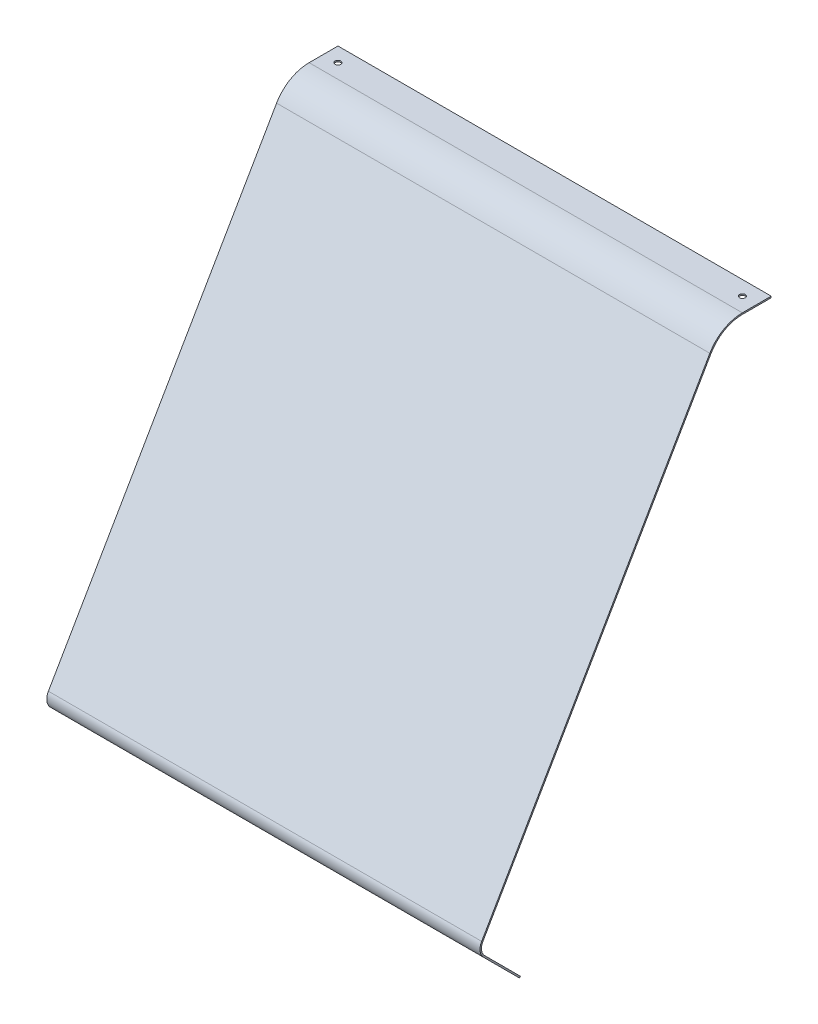
from build123d import *

# Parameters (mm, degrees)
SURFACE_EXTRUDE1_1_DEPTH = 600
THICKEN1_T1              = 2
SKETCH3_R                = 4
CUT_EXTRUDE1_DEPTH       = 2
SKETCH4_R                = 4
CUT_EXTRUDE2_DEPTH       = 2
LPATTERN1_COUNT          = 2
LPATTERN1_PITCH          = 560


with BuildPart() as body_1:
    # Surface-Extrude1: a surface, the sketch's curves swept straight by 600 mm
    with BuildLine(Plane(origin=(0, 0, 0), x_dir=(0, 0, -1), z_dir=(1, 0, 0)), mode=Mode.PRIVATE) as surface_extrude1_1_path:
        Line((0, 0), (-49.56534309, 49.56534309))
        ThreePointArc((-49.56534309, 49.56534309), (-53.830414293, 58.214051925), (-51.949122429, 67.671944808))
        Line((-51.949122429, 67.671944808), (264.050877571, 615))
        ThreePointArc((264.050877571, 615), (282.35214776, 633.301270189), (307.35214776, 640))
        Line((307.35214776, 640), (347.35214776, 640))
    surface_extrude1_1 = Shell.extrude(surface_extrude1_1_path.wire(), (1 * SURFACE_EXTRUDE1_1_DEPTH, 0 * SURFACE_EXTRUDE1_1_DEPTH, 0 * SURFACE_EXTRUDE1_1_DEPTH))
    add(Solid.thicken(surface_extrude1_1, THICKEN1_T1))

    # Sketch3 → Cut-Extrude1 (cut)
    with BuildSketch(Plane(origin=(0, -1.414213562, 1.414213562), x_dir=(1, 0, 0), z_dir=(0, -0.7071067811865517, 0.7071067811865434))):
        with Locations(Location((580, 33.095980422, 0), (0, 0, 270))):
            Circle(SKETCH3_R)
    cut_extrude1 = extrude(amount=-CUT_EXTRUDE1_DEPTH, mode=Mode.SUBTRACT)

    # Sketch4 → Cut-Extrude2 (cut)
    with BuildSketch(Plane(origin=(0, 642, 0), x_dir=(1, 0, 0), z_dir=(0, 1, 0))):
        with Locations(Location((580, 327.35214776, 0), (0, 0, 270))):
            Circle(SKETCH4_R)
    cut_extrude2 = extrude(amount=-CUT_EXTRUDE2_DEPTH, mode=Mode.SUBTRACT)

    # LPattern1: Cut-Extrude1, Cut-Extrude2 ×2
    with Locations(*[(-i * LPATTERN1_PITCH, 0, 0) for i in range(1, LPATTERN1_COUNT)]):
        add(cut_extrude1, mode=Mode.SUBTRACT)
        add(cut_extrude2, mode=Mode.SUBTRACT)


solid = body_1.part
